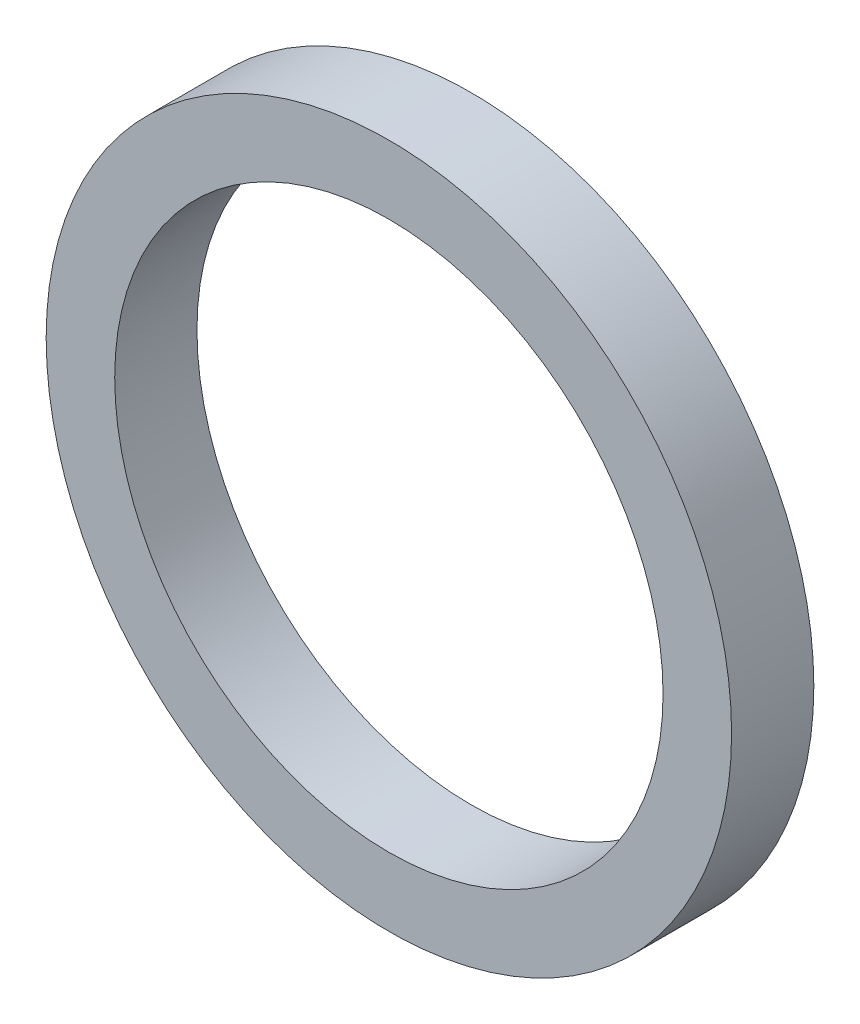
from build123d import *

# Parameters (mm, degrees)
SKETCH1_R           = 25
SKETCH1_R_2         = 20
BOSS_EXTRUDE1_DEPTH = 6


with BuildPart() as part:
    # Sketch1 → Boss-Extrude1 (new body)
    with BuildSketch(Plane.XY):
        Circle(SKETCH1_R)
        Circle(SKETCH1_R_2, mode=Mode.SUBTRACT)
    extrude(amount=BOSS_EXTRUDE1_DEPTH)


solid = part.part
